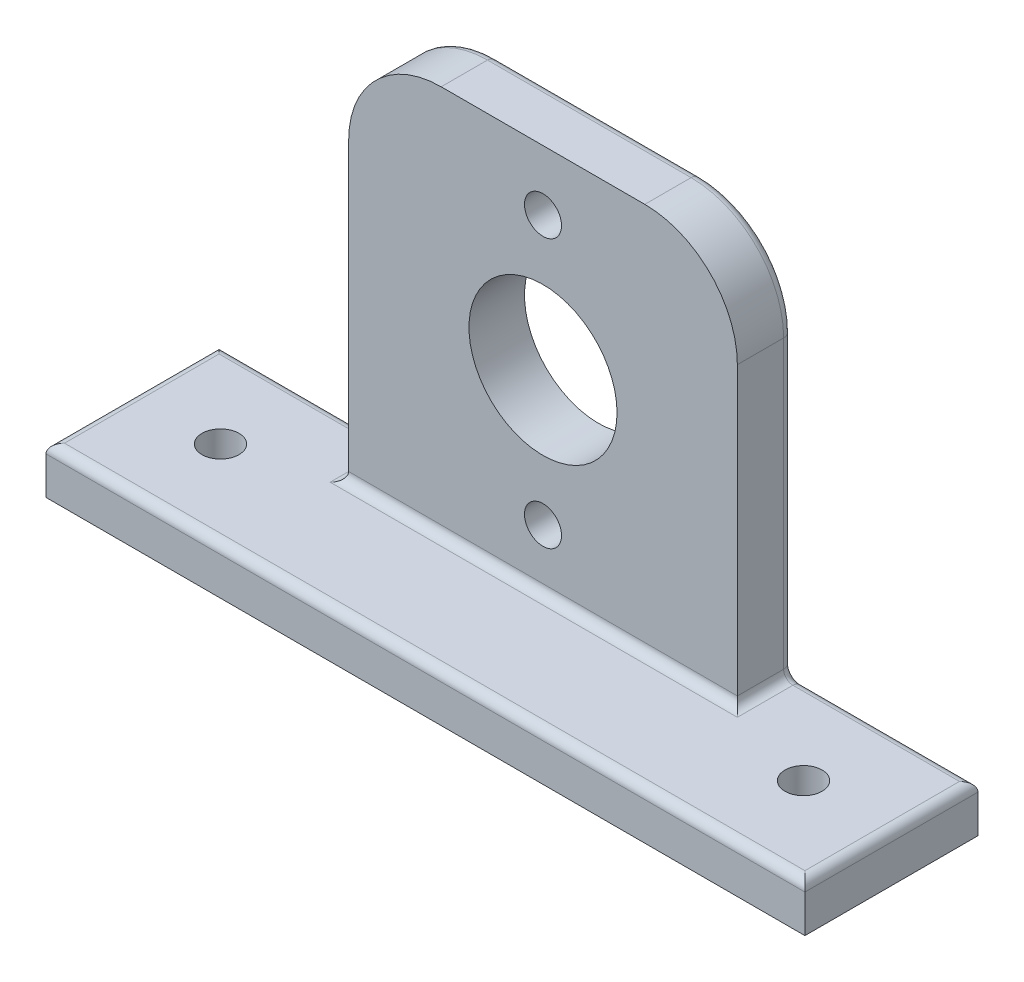
from build123d import *

# Parameters (mm, degrees)
SKETCH1_R           = 2
SKETCH1_R_2         = 8
BOSS_EXTRUDE1_DEPTH = 6
SKETCH2_W           = 12.7
SKETCH2_H           = 5.08
BOSS_EXTRUDE2_DEPTH = 82
FILLET1_R           = 10
FILLET2_R           = 10
FILLET4_R           = 1
SKETCH3_R           = 2
CUT_EXTRUDE1_DEPTH  = 6


with BuildPart() as part:
    # Sketch1 → Boss-Extrude1 (new body)
    with BuildSketch(Plane.XY):
        Polygon((0, 0), (82, 0), (82, 5.08), (62, 5.08), (62, 47.08), (20, 47.08), (20, 5.08), (0, 5.08), align=None)
        with Locations((41, 40.58)):
            Circle(SKETCH1_R, mode=Mode.SUBTRACT)
        with Locations((41, 11.58)):
            Circle(SKETCH1_R, mode=Mode.SUBTRACT)
        with Locations((41, 26.08)):
            Circle(SKETCH1_R_2, mode=Mode.SUBTRACT)
    extrude(amount=BOSS_EXTRUDE1_DEPTH)

    # Sketch2 → Boss-Extrude2 (add, through all)
    with BuildSketch(Plane(origin=(0, 0, 0), x_dir=(0, 0, -1), z_dir=(1, 0, 0))):
        with Locations((-12.35, 2.54)):
            Rectangle(SKETCH2_W, SKETCH2_H)
    extrude(amount=BOSS_EXTRUDE2_DEPTH)

    # Fillet1
    fillet1_edges = [part.edges().sort_by_distance(p)[0] for p in [
        (20, 47.08, 3),
    ]]
    fillet(fillet1_edges, radius=FILLET1_R)

    # Fillet2
    fillet2_edges = [part.edges().sort_by_distance(p)[0] for p in [
        (62, 47.08, 3),
    ]]
    fillet(fillet2_edges, radius=FILLET2_R)

    # Fillet4
    fillet4_edges = [part.edges().sort_by_distance(p)[0] for p in [
        (0, 5.08, 9.35),
        (20, 5.08, 3),
        (62, 5.08, 3),
        (82, 5.08, 9.35),
        (41, 5.08, 6),
        (41, 5.08, 18.7),
        (20, 21.08, 0),
        (22.928932188, 44.151067812, 0),
        (41, 47.08, 0),
        (59.071067812, 44.151067812, 0),
        (10, 5.08, 0),
        (62, 21.08, 0),
        (72, 5.08, 0),
    ]]
    fillet(fillet4_edges, radius=FILLET4_R)

    # Sketch3 → Cut-Extrude1 (cut)
    with BuildSketch(Plane(origin=(0, 0, 0), x_dir=(1, 0, 0), z_dir=(0, 1, 0))):
        with Locations((9.5, -9.35)):
            Circle(SKETCH3_R)
        with Locations((72.5, -9.35)):
            Circle(SKETCH3_R)
    extrude(amount=CUT_EXTRUDE1_DEPTH, mode=Mode.SUBTRACT)


solid = part.part
